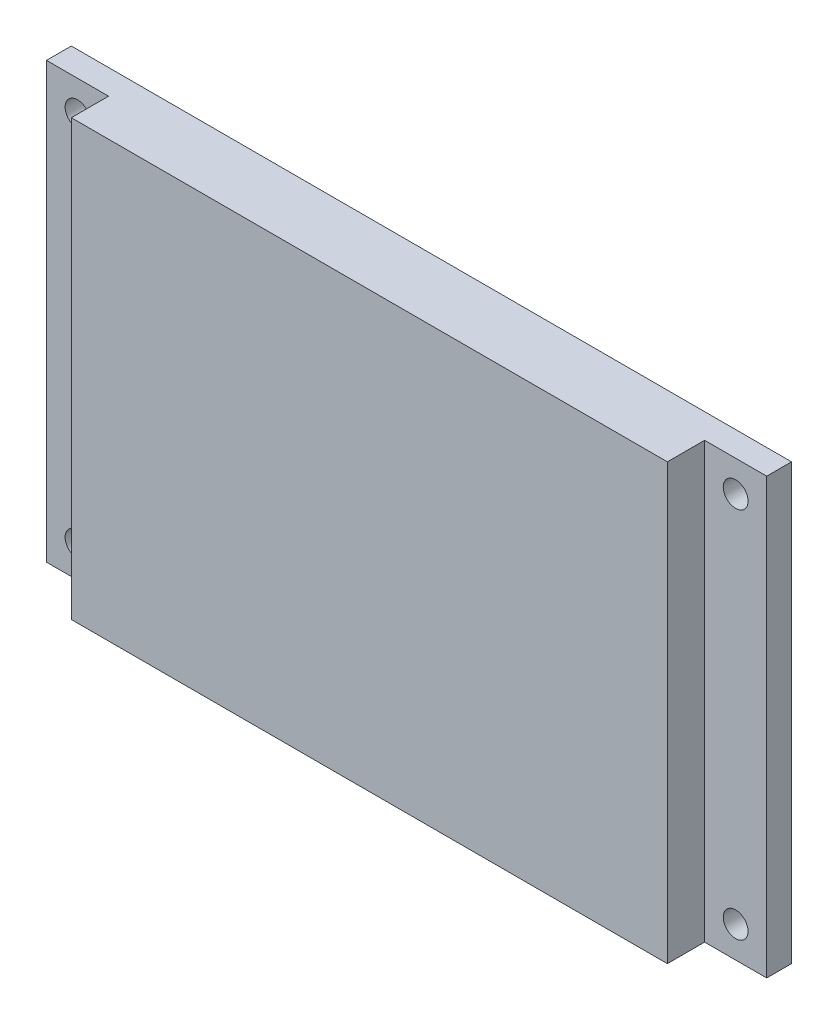
from build123d import *

# Parameters (mm, degrees)
SKETCH1_W           = 58
SKETCH1_H           = 35
SKETCH1_R           = 1
BOSS_EXTRUDE1_DEPTH = 2
SKETCH2_W           = 48
SKETCH2_H           = 35
BOSS_EXTRUDE2_DEPTH = 3


with BuildPart() as part:
    # Sketch1 → Boss-Extrude1 (new body)
    with BuildSketch(Plane.XY):
        with Locations((29, 17.5)):
            Rectangle(SKETCH1_W, SKETCH1_H)
        with Locations((2.5, 32.5)):
            Circle(SKETCH1_R, mode=Mode.SUBTRACT)
        with Locations(Location((55.5, 32.5, 0), (0, 0, 180))):
            Circle(SKETCH1_R, mode=Mode.SUBTRACT)
        with Locations(Location((2.5, 2.5, 0), (0, 0, 180))):
            Circle(SKETCH1_R, mode=Mode.SUBTRACT)
        with Locations((55.5, 2.5)):
            Circle(SKETCH1_R, mode=Mode.SUBTRACT)
    extrude(amount=BOSS_EXTRUDE1_DEPTH)

    # Sketch2 → Boss-Extrude2 (add)
    with BuildSketch(Plane.XY.offset(2)):
        with Locations((29, 17.5)):
            Rectangle(SKETCH2_W, SKETCH2_H)
    extrude(amount=BOSS_EXTRUDE2_DEPTH)


solid = part.part
